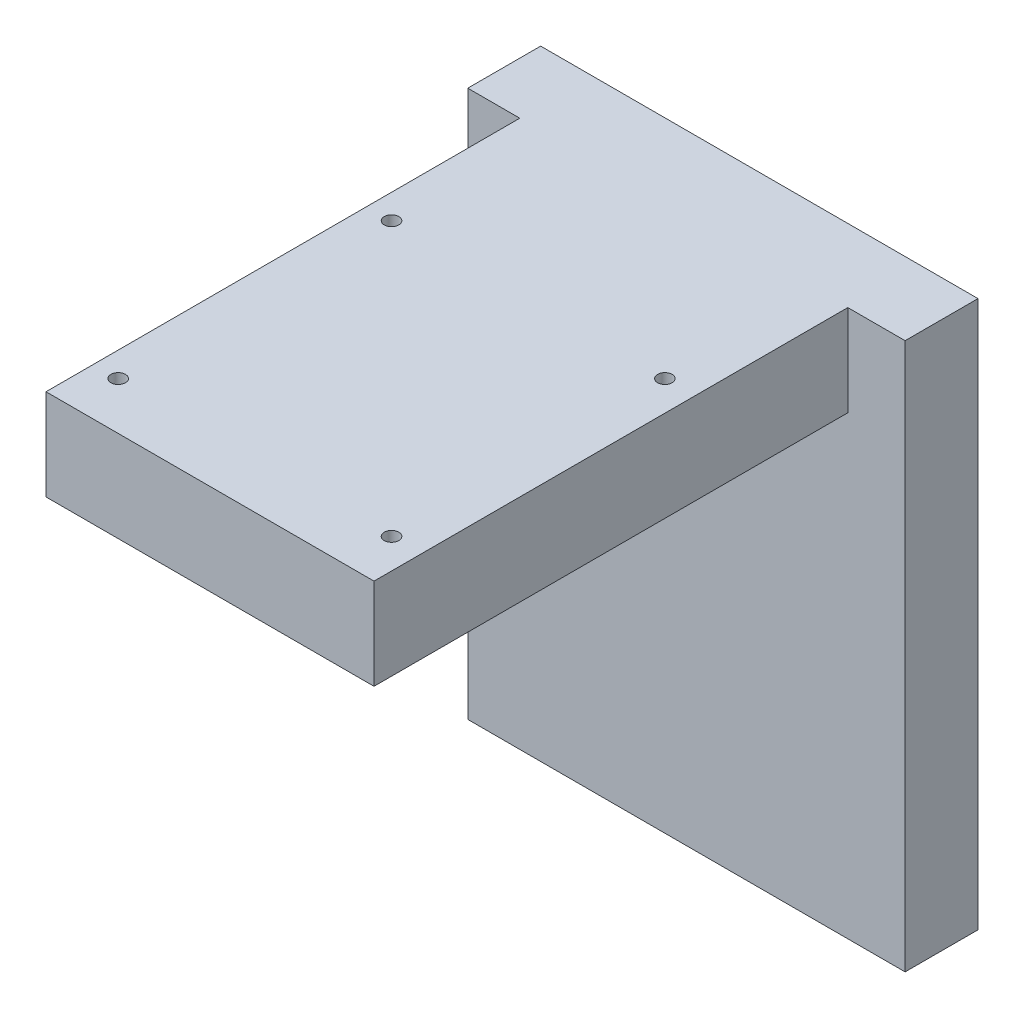
from build123d import *

# Parameters (mm, degrees)
SKETCH_1_W          = 120
SKETCH_1_H          = 20
EXTRUDE_1_DEPTH     = 150
SKETCH_2_W          = 90
SKETCH_2_H          = 25
EXTRUDE_2_DEPTH     = 130
SKETCH_3_R          = 2
CUT_EXTRUDE_1_DEPTH = 130
SKETCH_5_R          = 5
CUT_EXTRUDE_2_DEPTH = 17


with BuildPart() as part:
    # 草图1 → 凸台-拉伸1 (new body)
    with BuildSketch(Plane(origin=(0, 0, 0), x_dir=(1, 0, 0), z_dir=(0, 1, 0))):
        with Locations((-12.536231884, 9.565217391)):
            Rectangle(SKETCH_1_W, SKETCH_1_H)
    extrude(amount=EXTRUDE_1_DEPTH)

    # 草图2 → 凸台-拉伸2 (add)
    with BuildSketch(Plane.XY.offset(0.434782609)):
        with Locations((-13.26152797, 137.5)):
            Rectangle(SKETCH_2_W, SKETCH_2_H)
    extrude(amount=EXTRUDE_2_DEPTH)

    # 草图3 → 切除-拉伸1 (cut)
    with BuildSketch(Plane(origin=(0, 150, 0), x_dir=(1, 0, 0), z_dir=(0, 1, 0))):
        with Locations(Location((-51.492397045, -42.39796667, 0), (0, 0, 270))):
            Circle(SKETCH_3_R)
        with Locations(Location((23.507602913, -42.400462624, 0), (0, 0, 270))):
            Circle(SKETCH_3_R)
        with Locations(Location((-51.492397045, -117.400462624, 0), (0, 0, 270))):
            Circle(SKETCH_3_R)
        with Locations(Location((23.507602955, -117.400462624, 0), (0, 0, 270))):
            Circle(SKETCH_3_R)
    extrude(amount=-CUT_EXTRUDE_1_DEPTH, mode=Mode.SUBTRACT)

    # 草图5 → 切除-拉伸2 (cut)
    with BuildSketch(Plane.XZ.offset(-125)):
        with Locations((-51.492397045, 117.400462624)):
            Circle(SKETCH_5_R)
        with Locations((23.507602955, 117.400462624)):
            Circle(SKETCH_5_R)
        with Locations((23.507602913, 42.400462624)):
            Circle(SKETCH_5_R)
        with Locations((-51.492397045, 42.39796667)):
            Circle(SKETCH_5_R)
    extrude(amount=-CUT_EXTRUDE_2_DEPTH, mode=Mode.SUBTRACT)


solid = part.part
